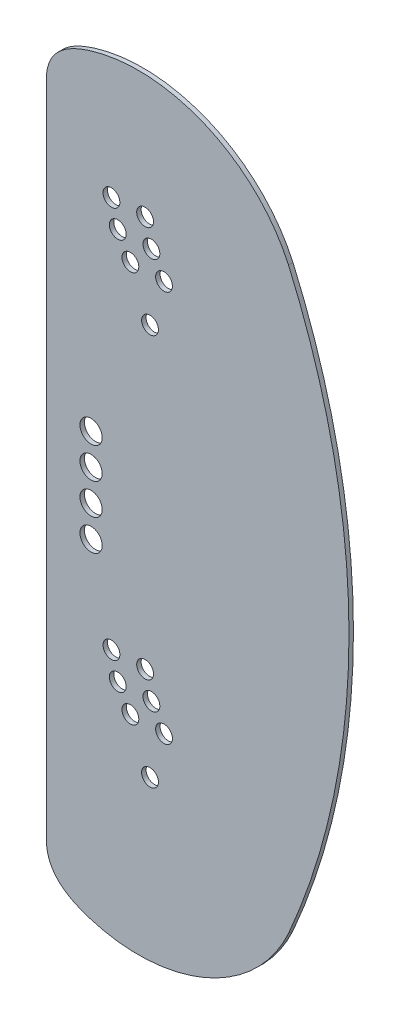
from build123d import *

# Parameters (mm, degrees)
SKETCH1_R           = 12.0000014
SKETCH1_R_2         = 11.999960371
SKETCH1_R_3         = 15.875
BOSS_EXTRUDE1_DEPTH = 6.35


with BuildPart() as part:
    # Sketch1 → Boss-Extrude1 (new body)
    with BuildSketch(Plane.XY):
        with BuildLine():
            add(Edge.make_bspline(
                [(1361.096561672, 1948.863494174), (1364.400827848, 1984.023171072), (1498.613211066, 2056.462277252), (1658.30760281, 1990.654880293), (1706.236065024, 1885.549246122)],
                knots=[0, 0, 0, 0, 0.219674411, 1, 1, 1, 1], degree=3))
            ThreePointArc((1706.236065024, 1885.549246122), (1792.519416012, 1472.613494175), (1706.236065024, 1059.677742228))
            add(Edge.make_bspline(
                [(1361.096561672, 996.363494176), (1364.400827848, 961.203817278), (1498.613211066, 888.764711097), (1658.30760281, 954.572108057), (1706.236065024, 1059.677742228)],
                knots=[0, 0, 0, 0, 0.219674411, 1, 1, 1, 1], degree=3))
            Line((1361.096561672, 996.363494176), (1361.096561672, 1948.863494174))
        make_face()
        with Locations((1453.664967726, 1842.614506828)):
            Circle(SKETCH1_R, mode=Mode.SUBTRACT)
        with Locations((1480.66492898, 1776.364555337)):
            Circle(SKETCH1_R_2, mode=Mode.SUBTRACT)
        with Locations((1462.664975126, 1807.614576828)):
            Circle(SKETCH1_R, mode=Mode.SUBTRACT)
        with Locations((1528.664893926, 1776.364575828)):
            Circle(SKETCH1_R, mode=Mode.SUBTRACT)
        with Locations((1510.664904526, 1807.614576828)):
            Circle(SKETCH1_R, mode=Mode.SUBTRACT)
        with Locations((1501.664897126, 1842.614506828)):
            Circle(SKETCH1_R, mode=Mode.SUBTRACT)
        with Locations((1424.596561672, 1405.938494174)):
            Circle(SKETCH1_R_3, mode=Mode.SUBTRACT)
        with Locations((1424.596561672, 1450.388494174)):
            Circle(SKETCH1_R_3, mode=Mode.SUBTRACT)
        with Locations((1424.596561672, 1494.838494174)):
            Circle(SKETCH1_R_3, mode=Mode.SUBTRACT)
        with Locations((1424.596561672, 1539.288494174)):
            Circle(SKETCH1_R_3, mode=Mode.SUBTRACT)
        with Locations((1501.664897126, 1283.814506828)):
            Circle(SKETCH1_R, mode=Mode.SUBTRACT)
        with Locations((1480.664970258, 1217.564562981)):
            Circle(SKETCH1_R, mode=Mode.SUBTRACT)
        with Locations((1528.664901326, 1217.564562981)):
            Circle(SKETCH1_R, mode=Mode.SUBTRACT)
        with Locations((1453.664901229, 1283.814468752)):
            Circle(SKETCH1_R, mode=Mode.SUBTRACT)
        with Locations((1508.664375126, 1712.614512828)):
            Circle(SKETCH1_R, mode=Mode.SUBTRACT)
        with Locations((1508.664375126, 1153.814512828)):
            Circle(SKETCH1_R, mode=Mode.SUBTRACT)
        with Locations((1462.664908629, 1248.814538752)):
            Circle(SKETCH1_R, mode=Mode.SUBTRACT)
        with Locations((1510.664904526, 1248.814576828)):
            Circle(SKETCH1_R, mode=Mode.SUBTRACT)
    extrude(amount=BOSS_EXTRUDE1_DEPTH)


solid = part.part
